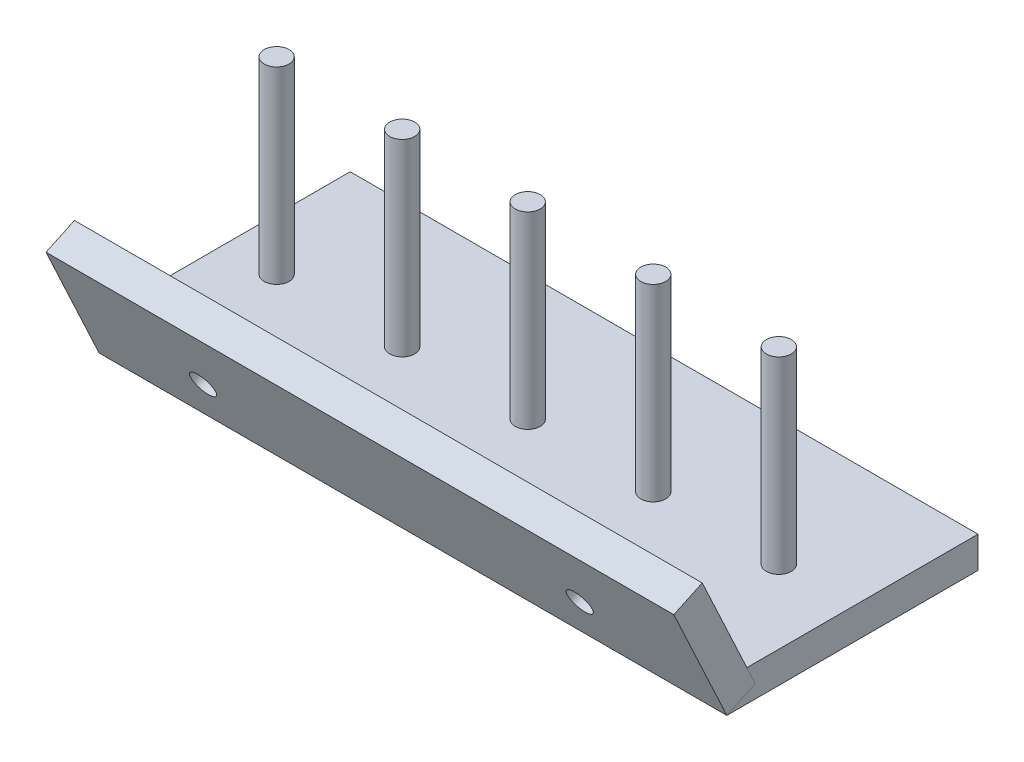
from build123d import *

# Parameters (mm, degrees)
ESQUISSE1_W                  = 100
ESQUISSE1_H                  = 40
BOSS_EXTRU_1_DEPTH           = 5
ESQUISSE3_W                  = 100
ESQUISSE3_H                  = 20
BOSS_EXTRU_2_DEPTH           = 5
ESQUISSE4_R                  = 1.989208733
BOSS_EXTRU_3_DEPTH           = 30
ESQUISSE5_R                  = 2
ENL_V_MAT_EXTRU_1_DEPTH      = 10
ENL_V_MAT_EXTRU_2_DEPTH      = 72.843330724
ENL_V_MAT_EXTRU_2_DEPTH_BACK = 2
ESQUISSE6_R                  = 2.995599757
ESQUISSE6_R_2                = 3


with BuildPart() as part:
    # Esquisse1 → Boss.-Extru.1 (new body)
    with BuildSketch(Plane(origin=(0, 0, 0), x_dir=(1, 0, 0), z_dir=(0, 1, 0))):
        Rectangle(ESQUISSE1_W, ESQUISSE1_H)
    extrude(amount=BOSS_EXTRU_1_DEPTH)

    # Esquisse4 → Boss.-Extru.3 (add)
    with BuildSketch(Plane(origin=(0, 5, 0), x_dir=(1, 0, 0), z_dir=(0, 1, 0))):
        with Locations(Location((38.280473345, 0, 0), (0, 0, 270))):
            Circle(ESQUISSE4_R)
        with Locations(Location((18.280473345, 0, 0), (0, 0, 270))):
            Circle(ESQUISSE4_R)
        with Locations(Location((-1.719526655, 0, 0), (0, 0, 270))):
            Circle(ESQUISSE4_R)
        with Locations(Location((-21.719526655, 0, 0), (0, 0, 270))):
            Circle(ESQUISSE4_R)
        with Locations(Location((-41.719526655, 0, 0), (0, 0, 270))):
            Circle(ESQUISSE4_R)
    extrude(amount=BOSS_EXTRU_3_DEPTH)


with BuildPart() as body_2:
    # Esquisse3 → Boss.-Extru.2 (new body)
    with BuildSketch(Plane(origin=(0, -7.660444431, 16.427876097), x_dir=(1, 0, 0), z_dir=(0, -0.4226182617407033, 0.9063077870366482))):
        with Locations((0, 18.452365235)):
            Rectangle(ESQUISSE3_W, ESQUISSE3_H)
    extrude(amount=-BOSS_EXTRU_2_DEPTH)

    # Esquisse5 → Enlèv. mat.-Extru.1 (cut)
    with BuildSketch(Plane(origin=(0, -7.660444431, 16.427876097), x_dir=(1, 0, 0), z_dir=(0, -0.4226182617407035, 0.906307787036648))):
        with Locations(Location((-30, 16.596133741, 0), (0, 0, 270))):
            Circle(ESQUISSE5_R)
        with Locations(Location((30, 16.596133741, 0), (0, 0, 270))):
            Circle(ESQUISSE5_R)
    extrude(amount=-ENL_V_MAT_EXTRU_1_DEPTH, mode=Mode.SUBTRACT)

    # Esquisse6 → Enlèv. mat.-Extru.2 (cut, two sides: drawn at the far end of the back side and taken through both)
    with BuildSketch(Plane(origin=(0, -5.547353122, 11.896337162), x_dir=(-1, 0, 0), z_dir=(0, 0.4226182617407035, -0.906307787036648)).offset(-ENL_V_MAT_EXTRU_2_DEPTH_BACK)):
        with Locations(Location((-30, 16.596133741, 0), (0, 0, 90))):
            Circle(ESQUISSE6_R)
        with Locations(Location((30, 16.596133741, 0), (0, 0, 90))):
            Circle(ESQUISSE6_R_2)
    extrude(amount=ENL_V_MAT_EXTRU_2_DEPTH + ENL_V_MAT_EXTRU_2_DEPTH_BACK, mode=Mode.SUBTRACT)


solid = Compound([part.part, body_2.part])
